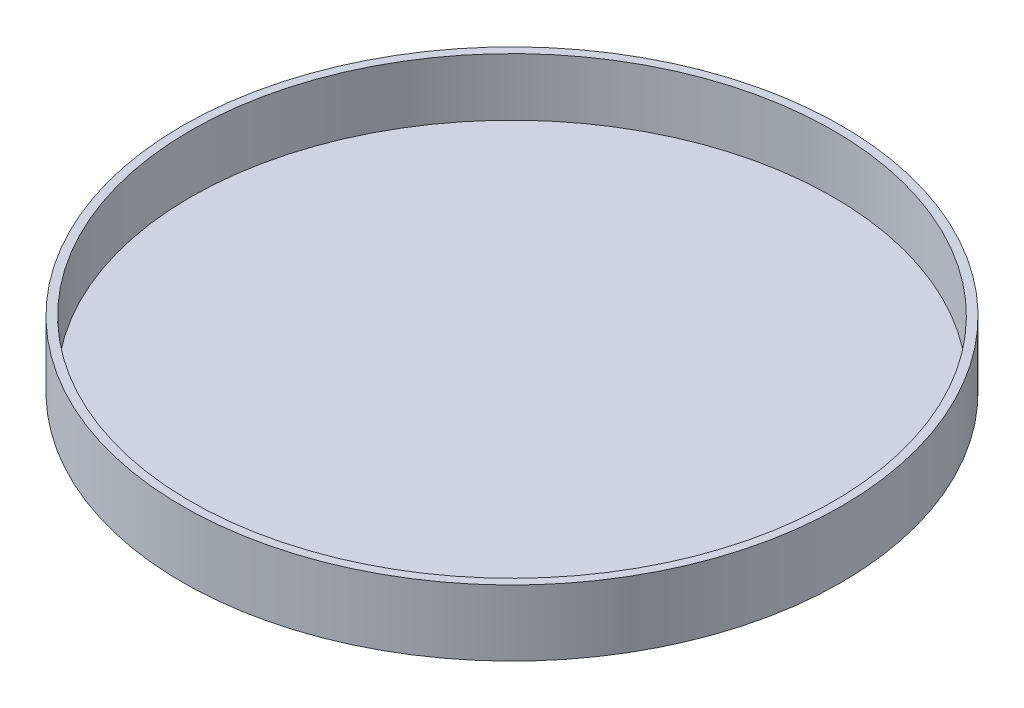
from build123d import *


with BuildPart() as part:
    # Sketch1 → Revolve1 (revolve)
    with BuildSketch(Plane.XY, mode=Mode.PRIVATE) as revolve1_sk:
        Polygon((0, 0), (200, 0), (200, 40), (195, 40), (195, 5), (0, 5), align=None)
    revolve(revolve1_sk.sketch.rotate(Axis((0, 5, 0), (0, -1, 0)), 180), axis=Axis((0, 5, 0), (0, -1, 0)))


solid = part.part
